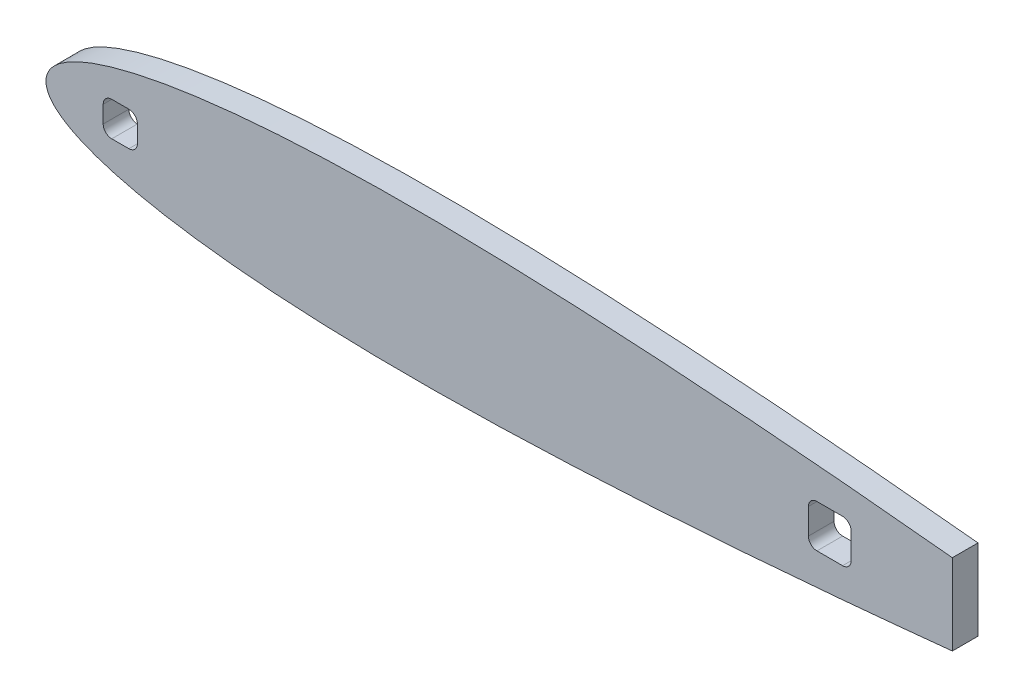
from build123d import *

# Parameters (mm, degrees)
RESSALTO_EXTRUS_O2_DEPTH = 6


with BuildPart() as part:
    # Esboço2 → Ressalto-extrusão2 (new body)
    with BuildSketch(Plane.XY):
        with BuildLine():
            Line((211.98, -9.451422222), (211.98, 9.451422222))
            add(Edge.make_bspline(
                [(211.98, 9.451422222), (210.449293437, 9.6082597), (206.819610413, 9.976377796), (201.045670114, 10.546432553), (194.618773945, 11.161570986), (188.072930048, 11.766272127), (181.423408252, 12.35855894), (174.685779509, 12.933535128), (167.875745185, 13.488628836), (161.009296544, 14.020295186), (154.102382848, 14.524266213), (147.171235613, 14.997381045), (140.232034626, 15.435860534), (133.300841971, 15.835469997), (126.393974261, 16.193049272), (119.527405079, 16.504694666), (112.717227702, 16.766934428), (105.979449387, 16.976857245), (99.329757113, 17.130729048), (92.783675138, 17.225837176), (86.356332786, 17.259508518), (80.062867459, 17.229742246), (73.918008224, 17.135200057), (67.936154462, 16.973024782), (62.131143707, 16.743934103), (56.516521191, 16.446281932), (51.10535847, 16.080902551), (45.910397606, 15.647872135), (40.943716573, 15.147977745), (36.216855618, 14.583115692), (31.740712003, 13.955581996), (27.52583046, 13.266546424), (23.581870696, 12.519452682), (19.917909677, 11.717109927), (16.542510367, 10.862238058), (13.463131357, 9.958666716), (10.686562668, 9.009396685), (8.218725484, 8.01770653), (6.064505003, 6.986457086), (4.228005296, 5.917795368), (2.711364889, 4.813532964), (1.517514344, 3.671853427), (0.649332664, 2.489522568), (0.118525016, 1.260761292), (-0.057774056, 0), (0.118525016, -1.260761292), (0.649332664, -2.489522568), (1.517514344, -3.671853427), (2.711364889, -4.813532964), (4.228005296, -5.917795368), (6.064505003, -6.986457086), (8.218725484, -8.01770653), (10.686562668, -9.009396685), (13.463131357, -9.958666716), (16.542510367, -10.862238058), (19.917909677, -11.717109927), (23.581870696, -12.519452682), (27.52583046, -13.266546424), (31.740712003, -13.955581996), (36.216855618, -14.583115692), (40.943716573, -15.147977745), (45.910397606, -15.647872135), (51.10535847, -16.080902551), (56.516521191, -16.446281932), (62.131143707, -16.743934103), (67.936154462, -16.973024782), (73.918008224, -17.135200057), (80.062867459, -17.229742246), (86.356332786, -17.259508518), (92.783675138, -17.225837176), (99.329757113, -17.130729048), (105.979449387, -16.976857245), (112.717227702, -16.766934428), (119.527405079, -16.504694666), (126.393974261, -16.193049272), (133.300841971, -15.835469997), (140.232034626, -15.435860534), (147.171235613, -14.997381045), (154.102382848, -14.524266213), (161.009296544, -14.020295186), (167.875745185, -13.488628836), (174.685779509, -12.933535128), (181.423408252, -12.35855894), (188.072930048, -11.766272127), (194.618773945, -11.161570986), (201.045670114, -10.546432553), (206.819610413, -9.976377796), (210.449293437, -9.6082597), (211.98, -9.451422222)],
                knots=[0.132893301, 0.132893301, 0.132893301, 0.132893301, 0.140700547, 0.151404252, 0.162331842, 0.173458675, 0.18475829, 0.196204076, 0.207768618, 0.219425945, 0.231147635, 0.242906359, 0.254675296, 0.26642621, 0.278132455, 0.289766477, 0.301301814, 0.312711646, 0.323969259, 0.33505005, 0.345928599, 0.356580621, 0.366981996, 0.377109776, 0.386942119, 0.396457905, 0.405636645, 0.41445907, 0.42290662, 0.430962851, 0.438611618, 0.445838275, 0.452630377, 0.458976173, 0.4648663, 0.470293868, 0.475254829, 0.479749124, 0.483781006, 0.48736258, 0.490515632, 0.493278566, 0.495712194, 0.497909944, 0.5, 0.502090056, 0.504287806, 0.506721434, 0.509484368, 0.51263742, 0.516218994, 0.520250876, 0.524745171, 0.529706132, 0.5351337, 0.541023827, 0.547369623, 0.554161725, 0.561388382, 0.569037149, 0.57709338, 0.58554093, 0.594363355, 0.603542095, 0.613057881, 0.622890224, 0.633018004, 0.643419379, 0.654071401, 0.66494995, 0.676030741, 0.687288354, 0.698698186, 0.710233523, 0.721867545, 0.73357379, 0.745324704, 0.757093641, 0.768852365, 0.780574055, 0.792231382, 0.803795924, 0.81524171, 0.826541325, 0.837668158, 0.848595748, 0.859299453, 0.867106699, 0.867106699, 0.867106699, 0.867106699], degree=3))
        make_face()
        with BuildLine():
            Line((186.31333333, -5), (180.31333333, -5))
            ThreePointArc((180.31333333, -5), (178.899119768, -4.414213562), (178.31333333, -3))
            Line((178.31333333, -3), (178.31333333, 3))
            ThreePointArc((178.31333333, 3), (178.899119768, 4.414213562), (180.31333333, 5))
            Line((180.31333333, 5), (186.31333333, 5))
            ThreePointArc((186.31333333, 5), (187.727546892, 4.414213562), (188.31333333, 3))
            Line((188.31333333, 3), (188.31333333, -3))
            ThreePointArc((188.31333333, -3), (187.727546892, -4.414213562), (186.31333333, -5))
        make_face(mode=Mode.SUBTRACT)
        with BuildLine():
            Line((19.38, -4), (15.38, -4))
            ThreePointArc((15.38, -4), (13.965786438, -3.414213562), (13.38, -2))
            Line((13.38, -2), (13.38, 2))
            ThreePointArc((13.38, 2), (13.965786438, 3.414213562), (15.38, 4))
            Line((15.38, 4), (19.38, 4))
            ThreePointArc((19.38, 4), (20.794213562, 3.414213562), (21.38, 2))
            Line((21.38, 2), (21.38, -2))
            ThreePointArc((21.38, -2), (20.794213562, -3.414213562), (19.38, -4))
        make_face(mode=Mode.SUBTRACT)
    extrude(amount=RESSALTO_EXTRUS_O2_DEPTH)


solid = part.part
